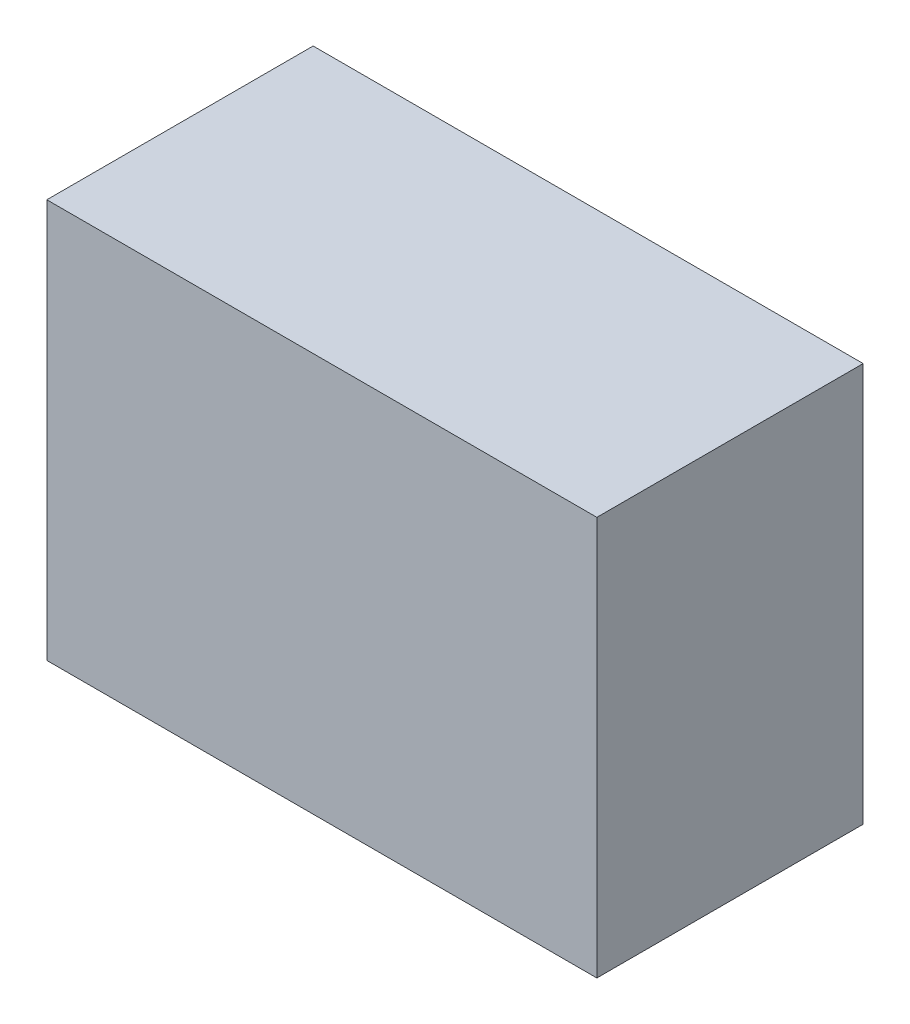
from build123d import *

# Parameters (mm, degrees)
SKETCH1_W           = 163.672421898
SKETCH1_H           = 118.72013701
BOSS_EXTRUDE1_DEPTH = 79.248


with BuildPart() as part:
    # Sketch1 → Boss-Extrude1 (new body)
    with BuildSketch(Plane.XY):
        Rectangle(SKETCH1_W, SKETCH1_H)
    extrude(amount=BOSS_EXTRUDE1_DEPTH)


solid = part.part
